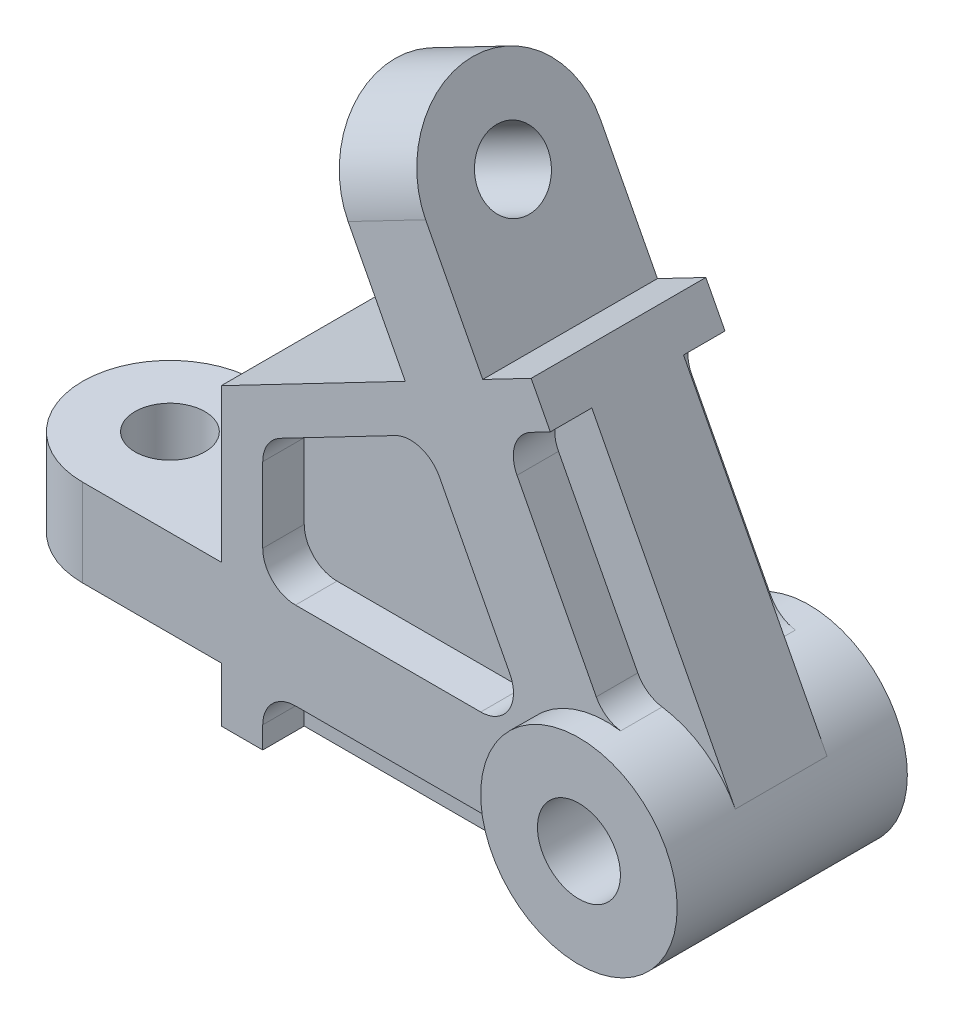
from build123d import *

# Parameters (mm, degrees)
ESQUISSE1_R             = 22.5
ESQUISSE1_R_2           = 9.5
BOSS_EXTRU_1_DEPTH      = 40
BOSS_EXTRU_2_DEPTH      = 6.35
BOSS_EXTRU_2_DEPTH_BACK = 46.35
ESQUISSE2_R             = 9.5
ESQUISSE3_R             = 8
ENL_V_MAT_EXTRU_1_DEPTH = 194.400037211
ESQUISSE4_R             = 8
ENL_V_MAT_EXTRU_2_DEPTH = 184.407892092
ENL_V_START             = -9.5
ENL_V_MAT_EXTRU_3_DEPTH = 9.5


with BuildPart() as part:
    # Esquisse1 → Boss.-Extru.1 (new body)
    # profile 1 of 2: a face of its own
    with BuildSketch(Plane.XY):
        with BuildLine():
            ThreePointArc((0, -22.5), (-19.23551709, 11.672398309), (19.957743747, 10.389343798))
            Line((19.957743747, 10.389343798), (-17.289116996, 81.93989757))
            Line((-17.289116996, 81.93989757), (-28.376752411, 76.168039905))
            Line((-28.376752411, 76.168039905), (-50.695462776, 119.041883612))
            Line((-50.695462776, 119.041883612), (-68.435679439, 109.806911348))
            Line((-68.435679439, 109.806911348), (-46.116969074, 66.93306764))
            Line((-46.116969074, 66.93306764), (-88.25, 45))
            Line((-88.25, 45), (-88.25, 10))
            Line((-88.25, 10), (-140, 10))
            Line((-140, 10), (-140, -10))
            Line((-140, -10), (-88.25, -10))
            Line((-88.25, -10), (-88.25, -22.5))
            Line((-88.25, -22.5), (0, -22.5))
        make_face()
    # profile 2 of 2: a face of its own
    with BuildSketch(Plane.XY):
        Circle(ESQUISSE1_R)
        Circle(ESQUISSE1_R_2, mode=Mode.SUBTRACT)
    extrude(amount=BOSS_EXTRU_1_DEPTH)

    # Esquisse2 → Boss.-Extru.2 (add, two sides: drawn at the far end of the back side and taken through both)
    with BuildSketch(Plane.XY.offset(40).offset(-BOSS_EXTRU_2_DEPTH_BACK)):
        with BuildLine():
            ThreePointArc((19.957743747, 10.389343798), (-19.23551709, 11.672398309), (0, -22.5))
            ThreePointArc((0, -22.5), (15.909902577, -15.909902577), (22.5, 0))
            ThreePointArc((22.5, 0), (21.855196571, 5.347932577), (19.957743747, 10.389343798))
        make_face()
        Circle(ESQUISSE2_R, mode=Mode.SUBTRACT)
    extrude(amount=BOSS_EXTRU_2_DEPTH + BOSS_EXTRU_2_DEPTH_BACK)

    # Esquisse3 → Enlèv. mat.-Extru.1 (cut, through all)
    with BuildSketch(Plane(origin=(8.870108332, 4.617486132, 0), x_dir=(0, 0, -1), z_dir=(0.8870108331782226, 0.4617486132350323, 0))):
        with BuildLine():
            ThreePointArc((-20, 129), (-5.857864376, 123.142135624), (0, 109))
            Line((0, 109), (0, 129))
            Line((0, 129), (-20, 129))
        make_face()
        with BuildLine():
            ThreePointArc((-40, 109), (-34.142135624, 123.142135624), (-20, 129))
            Line((-20, 129), (-40, 129))
            Line((-40, 129), (-40, 109))
        make_face()
        with Locations(Location((-20, 109, 0), (0, 0, 90))):
            Circle(ESQUISSE3_R)
    extrude(amount=-ENL_V_MAT_EXTRU_1_DEPTH, mode=Mode.SUBTRACT)

    # Esquisse4 → Enlèv. mat.-Extru.2 (cut, through all)
    with BuildSketch(Plane(origin=(0, 10, 0), x_dir=(1, 0, 0), z_dir=(0, 1, 0))):
        with Locations(Location((-120, -20, 0), (0, 0, 180))):
            Circle(ESQUISSE4_R)
        with BuildLine():
            ThreePointArc((-140, -20), (-134.142135624, -5.857864376), (-120, 0))
            Line((-120, 0), (-140, 0))
            Line((-140, 0), (-140, -20))
        make_face()
        with BuildLine():
            ThreePointArc((-120, -40), (-134.142135624, -34.142135624), (-140, -20))
            Line((-140, -20), (-140, -40))
            Line((-140, -40), (-120, -40))
        make_face()
    extrude(amount=-ENL_V_MAT_EXTRU_2_DEPTH, mode=Mode.SUBTRACT)

    # Esquisse5 → Enlèv. mat.-Extru.3 (cut)
    with BuildSketch(Plane.XY.offset(40).offset(ENL_V_START)):
        with BuildLine():
            ThreePointArc((-18.275239397, -13.125), (-20.943719878, -10.826826092), (-24.366985862, -10))
            Line((-24.366985862, -10), (-71.25, -10))
            ThreePointArc((-71.25, -10), (-76.553300859, -12.196699141), (-78.75, -17.5))
            Line((-78.75, -17.5), (-78.75, -22.5))
            Line((-78.75, -22.5), (0, -22.5))
            ThreePointArc((0, -22.5), (-10.269797953, -20.019521723), (-18.275239397, -13.125))
        make_face()
        with BuildLine():
            ThreePointArc((-2.381313599, 26.231266564), (-0.067221577, 23.576578352), (3.203450738, 22.270785872))
            ThreePointArc((3.203450738, 22.270785872), (13.01546768, 18.353408432), (19.957743747, 10.389343798))
            Line((19.957743747, 10.389343798), (-12.90250517, 73.513294655))
            Line((-12.90250517, 73.513294655), (-17.337559336, 71.204551589))
            ThreePointArc((-17.337559336, 71.204551589), (-21.027321868, 66.807263836), (-20.527025986, 61.08885574))
            Line((-20.527025986, 61.08885574), (-2.381313599, 26.231266564))
        make_face()
        with BuildLine():
            Line((-78.75, 17.5), (-78.75, 34.684146763))
            ThreePointArc((-78.75, 34.684146763), (-77.66183903, 38.574946199), (-74.713114599, 41.336728011))
            Line((-74.713114599, 41.336728011), (-48.382938497, 55.043350125))
            ThreePointArc((-48.382938497, 55.043350125), (-42.664530402, 55.543646007), (-38.267242649, 51.853883476))
            Line((-38.267242649, 51.853883476), (-22.186526206, 20.963114599))
            ThreePointArc((-22.186526206, 20.963114599), (-22.427268425, 13.609200564), (-28.839107455, 10))
            Line((-28.839107455, 10), (-71.25, 10))
            ThreePointArc((-71.25, 10), (-76.553300859, 12.196699141), (-78.75, 17.5))
        make_face()
    enl_v_mat_extru_3 = extrude(amount=ENL_V_MAT_EXTRU_3_DEPTH, mode=Mode.SUBTRACT)

    # Symétrie1: Enlèv. mat.-Extru.3 across plane
    add(enl_v_mat_extru_3.mirror(Plane(origin=(0, 0, 20), x_dir=(1, 0, 0), z_dir=(0, 0, -1))), mode=Mode.SUBTRACT)


solid = part.part
